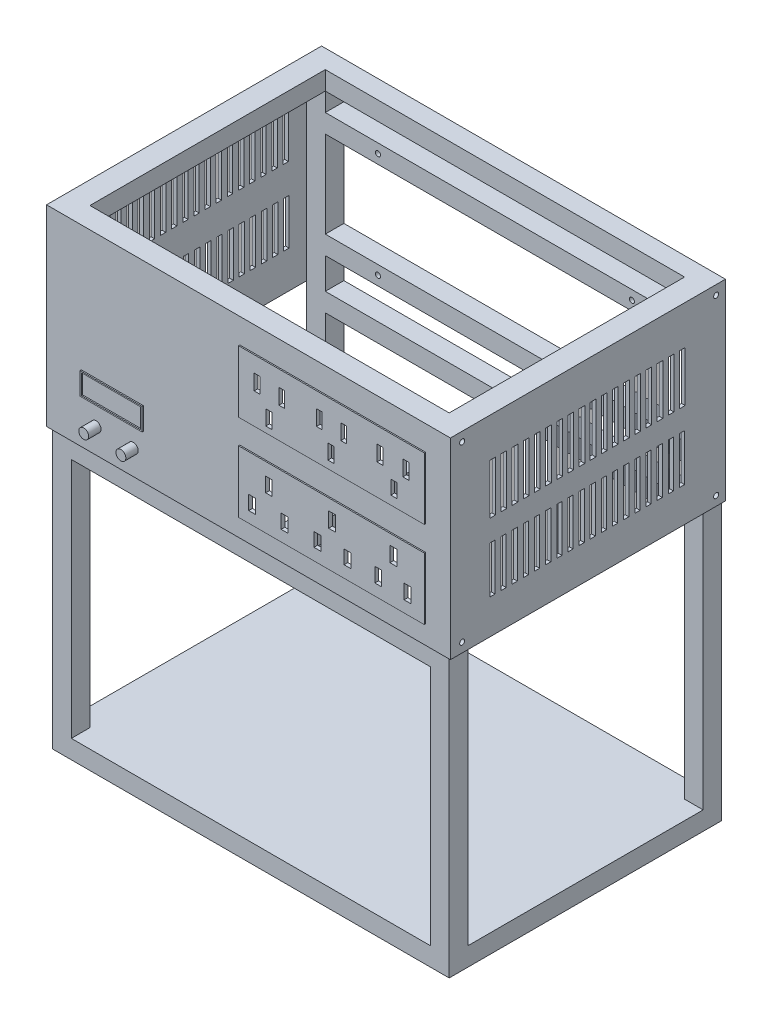
from build123d import *

# Parameters (mm, degrees)
SKETCH_1_W           = 320
SKETCH_1_H           = 220
EXTRUDE_2_DEPTH      = 380
SKETCH_3_W           = 290
SKETCH_3_H           = 350
CUT_EXTRUDE_1_DEPTH  = 220
SKETCH_4_W           = 190
SKETCH_4_H           = 350
CUT_EXTRUDE_2_DEPTH  = 320
SKETCH_5_W           = 290
SKETCH_5_H           = 190
CUT_EXTRUDE_3_DEPTH  = 15
SKETCH_6_W           = 290
SKETCH_6_H           = 15
EXTRUDE_3_DEPTH      = 15
SKETCH_7_W           = 290
SKETCH_7_H           = 15
EXTRUDE_4_DEPTH      = 15
SKETCH_8_R           = 2.05
CUT_EXTRUDE_4_DEPTH  = 15
SKETCH_9_R           = 2.05
CUT_EXTRUDE_5_DEPTH  = 15
SKETCH_10_R          = 2.05
CUT_EXTRUDE_6_DEPTH  = 15
SKETCH_11_R          = 2.05
CUT_EXTRUDE_7_DEPTH  = 15
SKETCH_12_W          = 290
SKETCH_12_H          = 15
EXTRUDE_5_DEPTH      = 15
SKETCH_13_W          = 290
SKETCH_13_H          = 15
EXTRUDE_6_DEPTH      = 15
SKETCH_14_W          = 15
SKETCH_14_H          = 15
EXTRUDE_7_DEPTH      = 220
SKETCH_15_W          = 220
SKETCH_15_H          = 155.000058457
EXTRUDE_9_DEPTH      = 3
SKETCH_17_R          = 2.05
CUT_EXTRUDE_9_DEPTH  = 3
SKETCH_18_R          = 2.05
CUT_EXTRUDE_10_DEPTH = 3
SKETCH_19_R          = 2.05
CUT_EXTRUDE_11_DEPTH = 3
SKETCH_20_R          = 2.05
CUT_EXTRUDE_12_DEPTH = 3
SKETCH_21_W          = 220
SKETCH_21_H          = 155.060128196
EXTRUDE_10_DEPTH     = 3
CUT_EXTRUDE_START    = -3
SKETCH_22_R          = 2.05
CUT_EXTRUDE_13_DEPTH = 3
SKETCH_23_R          = 2.05
CUT_EXTRUDE_14_DEPTH = 3
SKETCH_24_R          = 2.05
CUT_EXTRUDE_15_DEPTH = 3
SKETCH_25_R          = 2.05
CUT_EXTRUDE_16_DEPTH = 3
SKETCH_26_W          = 326
SKETCH_26_H          = 155.000058457
EXTRUDE_11_DEPTH     = 2
SKETCH_27_R          = 4
EXTRUDE_12_DEPTH     = 10
SKETCH_28_R          = 4
EXTRUDE_13_DEPTH     = 10
SKETCH_29_W          = 50
SKETCH_29_H          = 18
EXTRUDE_14_DEPTH     = 1
SKETCH_30_W          = 47.884184658
SKETCH_30_H          = 16.004072413
CUT_EXTRUDE_17_DEPTH = 1
SKETCH_31_W          = 150
SKETCH_31_H          = 50
EXTRUDE_15_DEPTH     = 1
SKETCH_35_W          = 4.499914726
SKETCH_35_H          = 12.461302318
SKETCH_35_W_2        = 5.019135656
SKETCH_35_H_2        = 12.115155031
CUT_EXTRUDE_18_DEPTH = 15
SKETCH_36_W          = 4.491620012
SKETCH_36_H          = 12.476722257
SKETCH_36_W_2        = 4.491620013
SKETCH_36_W_3        = 4.990688902
SKETCH_36_H_2        = 11.977653366
CUT_EXTRUDE_19_DEPTH = 15
SKETCH_37_W          = 4.86592168
SKETCH_37_H          = 12.601489479
SKETCH_37_W_2        = 5.115456125
SKETCH_37_H_2        = 11.229050031
CUT_EXTRUDE_20_DEPTH = 15
SKETCH_38_W          = 5.268219785
SKETCH_38_H          = 11.688862646
SKETCH_38_W_2        = 5.432851652
SKETCH_38_H_2        = 11.35959891
SKETCH_38_W_3        = 5.597483521
CUT_EXTRUDE_21_DEPTH = 15
SKETCH_39_W          = 5.432851652
SKETCH_39_H          = 12.182758251
SKETCH_39_W_2        = 5.597483521
SKETCH_39_H_2        = 11.030335173
SKETCH_39_W_3        = 5.432851653
CUT_EXTRUDE_22_DEPTH = 15
SKETCH_40_W          = 5.597483521
SKETCH_40_H          = 12.182758251
SKETCH_40_W_2        = 5.268219784
SKETCH_40_H_2        = 11.688862647
SKETCH_40_W_3        = 5.432851652
CUT_EXTRUDE_23_DEPTH = 15
SKETCH_41_W          = 4.27387979
SKETCH_41_H          = 35.491784345
CUT_EXTRUDE_26_DEPTH = 10
SKETCH_42_W          = 4.379051678
SKETCH_42_H          = 36.82384365
CUT_EXTRUDE_27_DEPTH = 10
SKETCH_43_W          = 4.615828939
SKETCH_43_H          = 40.516720687
CUT_EXTRUDE_28_DEPTH = 10
SKETCH_44_W          = 4.195645944
SKETCH_44_H          = 37.760813499
CUT_EXTRUDE_29_DEPTH = 10


with BuildPart() as part:
    # 草图1 → 凸台-拉伸2 (new body)
    with BuildSketch(Plane(origin=(0, 0, 0), x_dir=(1, 0, 0), z_dir=(0, 1, 0))):
        Rectangle(SKETCH_1_W, SKETCH_1_H)
    extrude(amount=EXTRUDE_2_DEPTH)

    # 草图3 → 切除-拉伸1 (cut)
    with BuildSketch(Plane.XY.offset(110)):
        with Locations((0, 190)):
            Rectangle(SKETCH_3_W, SKETCH_3_H)
    extrude(amount=-CUT_EXTRUDE_1_DEPTH, mode=Mode.SUBTRACT)

    # 草图4 → 切除-拉伸2 (cut)
    with BuildSketch(Plane(origin=(160, 0, 0), x_dir=(0, 0, -1), z_dir=(1, 0, 0))):
        with Locations((0, 190)):
            Rectangle(SKETCH_4_W, SKETCH_4_H)
    extrude(amount=-CUT_EXTRUDE_2_DEPTH, mode=Mode.SUBTRACT)

    # 草图5 → 切除-拉伸3 (cut)
    with BuildSketch(Plane(origin=(0, 380, 0), x_dir=(1, 0, 0), z_dir=(0, 1, 0))):
        Rectangle(SKETCH_5_W, SKETCH_5_H)
    extrude(amount=-CUT_EXTRUDE_3_DEPTH, mode=Mode.SUBTRACT)

    # 草图6 → 凸台-拉伸3 (add)
    with BuildSketch(Plane(origin=(0, 0, -110), x_dir=(-1, 0, 0), z_dir=(0, 0, -1))):
        with Locations((0, 342.5)):
            Rectangle(SKETCH_6_W, SKETCH_6_H)
    extrude(amount=-EXTRUDE_3_DEPTH)

    # 草图7 → 凸台-拉伸4 (add)
    with BuildSketch(Plane(origin=(0, 0, -110), x_dir=(-1, 0, 0), z_dir=(0, 0, -1))):
        with Locations((0, 257.5)):
            Rectangle(SKETCH_7_W, SKETCH_7_H)
    extrude(amount=-EXTRUDE_4_DEPTH)

    # 草图8 → 切除-拉伸4 (cut)
    with BuildSketch(Plane(origin=(0, 0, -110), x_dir=(-1, 0, 0), z_dir=(0, 0, -1))):
        with Locations((-102.5, 342.5)):
            Circle(SKETCH_8_R)
    extrude(amount=-CUT_EXTRUDE_4_DEPTH, mode=Mode.SUBTRACT)

    # 草图9 → 切除-拉伸5 (cut)
    with BuildSketch(Plane(origin=(0, 0, -110), x_dir=(-1, 0, 0), z_dir=(0, 0, -1))):
        with Locations((102.5, 342.5)):
            Circle(SKETCH_9_R)
    extrude(amount=-CUT_EXTRUDE_5_DEPTH, mode=Mode.SUBTRACT)

    # 草图10 → 切除-拉伸6 (cut)
    with BuildSketch(Plane(origin=(0, 0, -110), x_dir=(-1, 0, 0), z_dir=(0, 0, -1))):
        with Locations((-102.5, 257.5)):
            Circle(SKETCH_10_R)
    extrude(amount=-CUT_EXTRUDE_6_DEPTH, mode=Mode.SUBTRACT)

    # 草图11 → 切除-拉伸7 (cut)
    with BuildSketch(Plane(origin=(0, 0, -110), x_dir=(-1, 0, 0), z_dir=(0, 0, -1))):
        with Locations((102.5, 257.5)):
            Circle(SKETCH_11_R)
    extrude(amount=-CUT_EXTRUDE_7_DEPTH, mode=Mode.SUBTRACT)

    # 草图12 → 凸台-拉伸5 (add)
    with BuildSketch(Plane.XY.offset(110)):
        with Locations((0, 217.5)):
            Rectangle(SKETCH_12_W, SKETCH_12_H)
    extrude(amount=-EXTRUDE_5_DEPTH)

    # 草图13 → 凸台-拉伸6 (add)
    with BuildSketch(Plane(origin=(0, 0, -110), x_dir=(-1, 0, 0), z_dir=(0, 0, -1))):
        with Locations((0, 217.5)):
            Rectangle(SKETCH_13_W, SKETCH_13_H)
    extrude(amount=-EXTRUDE_6_DEPTH)

    # 草图14 → 凸台-拉伸7 (add)
    with BuildSketch(Plane(origin=(0, 0, -110), x_dir=(-1, 0, 0), z_dir=(0, 0, -1))):
        with Locations((-7.5, 217.5)):
            Rectangle(SKETCH_14_W, SKETCH_14_H)
    extrude(amount=-EXTRUDE_7_DEPTH)

    # 草图15 → 凸台-拉伸9 (add)
    with BuildSketch(Plane(origin=(160, 0, 0), x_dir=(0, 0, -1), z_dir=(1, 0, 0))):
        with Locations((0, 302.499970771)):
            Rectangle(SKETCH_15_W, SKETCH_15_H)
    extrude(amount=EXTRUDE_9_DEPTH)

    # 草图17 → 切除-拉伸9 (cut)
    with BuildSketch(Plane(origin=(163, 0, 0), x_dir=(0, 0, -1), z_dir=(1, 0, 0))):
        with Locations((-102.5, 372.5)):
            Circle(SKETCH_17_R)
    extrude(amount=-CUT_EXTRUDE_9_DEPTH, mode=Mode.SUBTRACT)

    # 草图18 → 切除-拉伸10 (cut)
    with BuildSketch(Plane(origin=(163, 0, 0), x_dir=(0, 0, -1), z_dir=(1, 0, 0))):
        with Locations((102.5, 372.5)):
            Circle(SKETCH_18_R)
    extrude(amount=-CUT_EXTRUDE_10_DEPTH, mode=Mode.SUBTRACT)

    # 草图19 → 切除-拉伸11 (cut)
    with BuildSketch(Plane(origin=(163, 0, 0), x_dir=(0, 0, -1), z_dir=(1, 0, 0))):
        with Locations((-102.5, 232.499941543)):
            Circle(SKETCH_19_R)
    extrude(amount=-CUT_EXTRUDE_11_DEPTH, mode=Mode.SUBTRACT)

    # 草图20 → 切除-拉伸12 (cut)
    with BuildSketch(Plane(origin=(163, 0, 0), x_dir=(0, 0, -1), z_dir=(1, 0, 0))):
        with Locations((102.5, 232.499941543)):
            Circle(SKETCH_20_R)
    extrude(amount=-CUT_EXTRUDE_12_DEPTH, mode=Mode.SUBTRACT)

    # 草图21 → 凸台-拉伸10 (add)
    with BuildSketch(Plane.ZY.offset(160)):
        with Locations((0, 302.469935902)):
            Rectangle(SKETCH_21_W, SKETCH_21_H)
    extrude(amount=EXTRUDE_10_DEPTH)

    # 草图22 → 切除-拉伸13 (cut)
    with BuildSketch(Plane.ZY.offset(163).offset(CUT_EXTRUDE_START)):
        with Locations(Location((-102.5, 372.5, 0), (0, 0, 180))):
            Circle(SKETCH_22_R)
    extrude(amount=CUT_EXTRUDE_13_DEPTH, mode=Mode.SUBTRACT)

    # 草图23 → 切除-拉伸14 (cut)
    with BuildSketch(Plane.ZY.offset(163).offset(CUT_EXTRUDE_START)):
        with Locations(Location((102.5, 372.5, 0), (0, 0, 180))):
            Circle(SKETCH_23_R)
    extrude(amount=CUT_EXTRUDE_14_DEPTH, mode=Mode.SUBTRACT)

    # 草图24 → 切除-拉伸15 (cut)
    with BuildSketch(Plane.ZY.offset(163)):
        with Locations((-102.5, 232.439871804)):
            Circle(SKETCH_24_R)
    extrude(amount=-CUT_EXTRUDE_15_DEPTH, mode=Mode.SUBTRACT)

    # 草图25 → 切除-拉伸16 (cut)
    with BuildSketch(Plane.ZY.offset(163)):
        with Locations((102.5, 232.439871804)):
            Circle(SKETCH_25_R)
    extrude(amount=-CUT_EXTRUDE_16_DEPTH, mode=Mode.SUBTRACT)

    # 草图26 → 凸台-拉伸11 (add)
    with BuildSketch(Plane.XY.offset(110)):
        with Locations((0, 302.499970771)):
            Rectangle(SKETCH_26_W, SKETCH_26_H)
    extrude(amount=EXTRUDE_11_DEPTH)

    # 草图27 → 凸台-拉伸12 (add)
    with BuildSketch(Plane.XY.offset(112)):
        with Locations((-123, 244.999941543)):
            Circle(SKETCH_27_R)
    extrude(amount=EXTRUDE_12_DEPTH)

    # 草图28 → 凸台-拉伸13 (add)
    with BuildSketch(Plane.XY.offset(112)):
        with Locations((-93, 244.999941543)):
            Circle(SKETCH_28_R)
    extrude(amount=EXTRUDE_13_DEPTH)

    # 草图29 → 凸台-拉伸14 (add)
    with BuildSketch(Plane.XY.offset(112)):
        with Locations((-109.907202063, 269.647198379)):
            Rectangle(SKETCH_29_W, SKETCH_29_H)
    extrude(amount=EXTRUDE_14_DEPTH)

    # 草图30 → 切除-拉伸17 (cut)
    with BuildSketch(Plane.XY.offset(113)):
        with Locations((-109.918600748, 269.66734461)):
            Rectangle(SKETCH_30_W, SKETCH_30_H)
    extrude(amount=-CUT_EXTRUDE_17_DEPTH, mode=Mode.SUBTRACT)

    # 草图31 → 凸台-拉伸15 (add)
    with BuildSketch(Plane.XY.offset(112)):
        with Locations((68, 335)):
            Rectangle(SKETCH_31_W, SKETCH_31_H)
        with Locations((68, 265)):
            Rectangle(SKETCH_31_W, SKETCH_31_H)
    extrude(amount=EXTRUDE_15_DEPTH)

    # 草图35 → 切除-拉伸18 (cut)
    with BuildSketch(Plane.XY.offset(113)):
        with Locations((7.855850568, 340.923710735)):
            Rectangle(SKETCH_35_W, SKETCH_35_H)
        with Locations((27.759319548, 340.923710735)):
            Rectangle(SKETCH_35_W, SKETCH_35_H)
        with Locations((17.461437772, 320.847168112)):
            Rectangle(SKETCH_35_W_2, SKETCH_35_H_2)
    extrude(amount=-CUT_EXTRUDE_18_DEPTH, mode=Mode.SUBTRACT)

    # 草图36 → 切除-拉伸19 (cut)
    with BuildSketch(Plane.XY.offset(113)):
        with Locations((58.103935401, 341.188883591)):
            Rectangle(SKETCH_36_W, SKETCH_36_H)
        with Locations((77.817156567, 341.188883591)):
            Rectangle(SKETCH_36_W_2, SKETCH_36_H)
        with Locations((67.586244316, 322.099498538)):
            Rectangle(SKETCH_36_W_3, SKETCH_36_H_2)
    extrude(amount=-CUT_EXTRUDE_19_DEPTH, mode=Mode.SUBTRACT)

    # 草图37 → 切除-拉伸20 (cut)
    with BuildSketch(Plane.XY.offset(113)):
        with Locations((107.075070259, 340.876965535)):
            Rectangle(SKETCH_37_W, SKETCH_37_H)
        with Locations((128.160730873, 340.876965535)):
            Rectangle(SKETCH_37_W_2, SKETCH_37_H)
        with Locations((118.30412029, 322.598567429)):
            Rectangle(SKETCH_37_W, SKETCH_37_H_2)
    extrude(amount=-CUT_EXTRUDE_20_DEPTH, mode=Mode.SUBTRACT)

    # 草图38 → 切除-拉伸21 (cut)
    with BuildSketch(Plane.XY.offset(113)):
        with Locations((17.443434229, 273.926591144)):
            Rectangle(SKETCH_38_W, SKETCH_38_H)
        with Locations((3.861305097, 254.50003069)):
            Rectangle(SKETCH_38_W_2, SKETCH_38_H_2)
        with Locations((30.120088085, 254.50003069)):
            Rectangle(SKETCH_38_W_3, SKETCH_38_H_2)
    extrude(amount=-CUT_EXTRUDE_21_DEPTH, mode=Mode.SUBTRACT)

    # 草图39 → 切除-拉伸22 (cut)
    with BuildSketch(Plane.XY.offset(113)):
        with Locations((68.396997454, 274.832066419)):
            Rectangle(SKETCH_39_W, SKETCH_39_H)
        with Locations((56.625818874, 254.993926294)):
            Rectangle(SKETCH_39_W_2, SKETCH_39_H_2)
        with Locations((80.909019442, 254.993926294)):
            Rectangle(SKETCH_39_W_3, SKETCH_39_H_2)
    extrude(amount=-CUT_EXTRUDE_22_DEPTH, mode=Mode.SUBTRACT)

    # 草图40 → 切除-拉伸23 (cut)
    with BuildSketch(Plane.XY.offset(113)):
        with Locations((118.033505734, 275.490593892)):
            Rectangle(SKETCH_40_W, SKETCH_40_H)
        with Locations((105.686115614, 254.993926295)):
            Rectangle(SKETCH_40_W_2, SKETCH_40_H_2)
        with Locations((129.310788709, 254.993926295)):
            Rectangle(SKETCH_40_W_3, SKETCH_40_H_2)
    extrude(amount=-CUT_EXTRUDE_23_DEPTH, mode=Mode.SUBTRACT)

    # 草图41 → 切除-拉伸26 (cut)
    with BuildSketch(Plane.ZY.offset(163)):
        with Locations((-69.094256058, 333.347868575)):
            Rectangle(SKETCH_41_W, SKETCH_41_H)
        with Locations((-78.094256058, 333.347868575)):
            Rectangle(SKETCH_41_W, SKETCH_41_H)
        with Locations((-60.094256058, 333.347868575)):
            Rectangle(SKETCH_41_W, SKETCH_41_H)
        with Locations((-51.094256058, 333.347868575)):
            Rectangle(SKETCH_41_W, SKETCH_41_H)
        with Locations((-42.094256058, 333.347868575)):
            Rectangle(SKETCH_41_W, SKETCH_41_H)
        with Locations((-33.094256058, 333.347868575)):
            Rectangle(SKETCH_41_W, SKETCH_41_H)
        with Locations((-24.094256058, 333.347868575)):
            Rectangle(SKETCH_41_W, SKETCH_41_H)
        with Locations((-15.094256058, 333.347868575)):
            Rectangle(SKETCH_41_W, SKETCH_41_H)
        with Locations((-6.094256058, 333.347868575)):
            Rectangle(SKETCH_41_W, SKETCH_41_H)
        with Locations((2.905743942, 333.347868575)):
            Rectangle(SKETCH_41_W, SKETCH_41_H)
        with Locations((11.905743942, 333.347868575)):
            Rectangle(SKETCH_41_W, SKETCH_41_H)
        with Locations((20.905743942, 333.347868575)):
            Rectangle(SKETCH_41_W, SKETCH_41_H)
        with Locations((29.905743942, 333.347868575)):
            Rectangle(SKETCH_41_W, SKETCH_41_H)
        with Locations((38.905743942, 333.347868575)):
            Rectangle(SKETCH_41_W, SKETCH_41_H)
        with Locations((47.905743942, 333.347868575)):
            Rectangle(SKETCH_41_W, SKETCH_41_H)
        with Locations((56.905743942, 333.347868575)):
            Rectangle(SKETCH_41_W, SKETCH_41_H)
        with Locations((65.905743942, 333.347868575)):
            Rectangle(SKETCH_41_W, SKETCH_41_H)
        with Locations((74.905743942, 333.347868575)):
            Rectangle(SKETCH_41_W, SKETCH_41_H)
    extrude(amount=-CUT_EXTRUDE_26_DEPTH, mode=Mode.SUBTRACT)

    # 草图42 → 切除-拉伸27 (cut)
    with BuildSketch(Plane.ZY.offset(163)):
        with Locations((-69.575954165, 273.270029144)):
            Rectangle(SKETCH_42_W, SKETCH_42_H)
        with Locations((-78.575954165, 273.270029144)):
            Rectangle(SKETCH_42_W, SKETCH_42_H)
        with Locations((-60.575954165, 273.270029144)):
            Rectangle(SKETCH_42_W, SKETCH_42_H)
        with Locations((-51.575954165, 273.270029144)):
            Rectangle(SKETCH_42_W, SKETCH_42_H)
        with Locations((-42.575954165, 273.270029144)):
            Rectangle(SKETCH_42_W, SKETCH_42_H)
        with Locations((-33.575954165, 273.270029144)):
            Rectangle(SKETCH_42_W, SKETCH_42_H)
        with Locations((-24.575954165, 273.270029144)):
            Rectangle(SKETCH_42_W, SKETCH_42_H)
        with Locations((-15.575954165, 273.270029144)):
            Rectangle(SKETCH_42_W, SKETCH_42_H)
        with Locations((-6.575954165, 273.270029144)):
            Rectangle(SKETCH_42_W, SKETCH_42_H)
        with Locations((2.424045835, 273.270029144)):
            Rectangle(SKETCH_42_W, SKETCH_42_H)
        with Locations((11.424045835, 273.270029144)):
            Rectangle(SKETCH_42_W, SKETCH_42_H)
        with Locations((20.424045835, 273.270029144)):
            Rectangle(SKETCH_42_W, SKETCH_42_H)
        with Locations((29.424045835, 273.270029144)):
            Rectangle(SKETCH_42_W, SKETCH_42_H)
        with Locations((38.424045835, 273.270029144)):
            Rectangle(SKETCH_42_W, SKETCH_42_H)
        with Locations((47.424045835, 273.270029144)):
            Rectangle(SKETCH_42_W, SKETCH_42_H)
        with Locations((56.424045835, 273.270029144)):
            Rectangle(SKETCH_42_W, SKETCH_42_H)
        with Locations((65.424045835, 273.270029144)):
            Rectangle(SKETCH_42_W, SKETCH_42_H)
        with Locations((74.424045835, 273.270029144)):
            Rectangle(SKETCH_42_W, SKETCH_42_H)
    extrude(amount=-CUT_EXTRUDE_27_DEPTH, mode=Mode.SUBTRACT)

    # 草图43 → 切除-拉伸28 (cut)
    with BuildSketch(Plane(origin=(163, 0, 0), x_dir=(0, 0, -1), z_dir=(1, 0, 0))):
        with Locations((-68.863550231, 328.209321002)):
            Rectangle(SKETCH_43_W, SKETCH_43_H)
        with Locations((-77.863550231, 328.209321002)):
            Rectangle(SKETCH_43_W, SKETCH_43_H)
        with Locations((-59.863550231, 328.209321002)):
            Rectangle(SKETCH_43_W, SKETCH_43_H)
        with Locations((-50.863550231, 328.209321002)):
            Rectangle(SKETCH_43_W, SKETCH_43_H)
        with Locations((-41.863550231, 328.209321002)):
            Rectangle(SKETCH_43_W, SKETCH_43_H)
        with Locations((-32.863550231, 328.209321002)):
            Rectangle(SKETCH_43_W, SKETCH_43_H)
        with Locations((-23.863550231, 328.209321002)):
            Rectangle(SKETCH_43_W, SKETCH_43_H)
        with Locations((-14.863550232, 328.209321002)):
            Rectangle(SKETCH_43_W, SKETCH_43_H)
        with Locations((-5.863550231, 328.209321002)):
            Rectangle(SKETCH_43_W, SKETCH_43_H)
        with Locations((3.136449769, 328.209321002)):
            Rectangle(SKETCH_43_W, SKETCH_43_H)
        with Locations((12.136449769, 328.209321002)):
            Rectangle(SKETCH_43_W, SKETCH_43_H)
        with Locations((21.136449769, 328.209321002)):
            Rectangle(SKETCH_43_W, SKETCH_43_H)
        with Locations((30.136449769, 328.209321002)):
            Rectangle(SKETCH_43_W, SKETCH_43_H)
        with Locations((39.136449769, 328.209321002)):
            Rectangle(SKETCH_43_W, SKETCH_43_H)
        with Locations((48.136449769, 328.209321002)):
            Rectangle(SKETCH_43_W, SKETCH_43_H)
        with Locations((57.136449769, 328.209321002)):
            Rectangle(SKETCH_43_W, SKETCH_43_H)
        with Locations((66.136449769, 328.209321002)):
            Rectangle(SKETCH_43_W, SKETCH_43_H)
        with Locations((75.136449769, 328.209321002)):
            Rectangle(SKETCH_43_W, SKETCH_43_H)
    extrude(amount=-CUT_EXTRUDE_28_DEPTH, mode=Mode.SUBTRACT)

    # 草图44 → 切除-拉伸29 (cut)
    with BuildSketch(Plane(origin=(163, 0, 0), x_dir=(0, 0, -1), z_dir=(1, 0, 0))):
        with Locations((-69.069774651, 271.78487947)):
            Rectangle(SKETCH_44_W, SKETCH_44_H)
        with Locations((-78.069774651, 271.78487947)):
            Rectangle(SKETCH_44_W, SKETCH_44_H)
        with Locations((-60.069774651, 271.78487947)):
            Rectangle(SKETCH_44_W, SKETCH_44_H)
        with Locations((-51.069774651, 271.78487947)):
            Rectangle(SKETCH_44_W, SKETCH_44_H)
        with Locations((-42.069774651, 271.78487947)):
            Rectangle(SKETCH_44_W, SKETCH_44_H)
        with Locations((-33.069774651, 271.78487947)):
            Rectangle(SKETCH_44_W, SKETCH_44_H)
        with Locations((-24.069774651, 271.78487947)):
            Rectangle(SKETCH_44_W, SKETCH_44_H)
        with Locations((-15.069774651, 271.78487947)):
            Rectangle(SKETCH_44_W, SKETCH_44_H)
        with Locations((-6.069774651, 271.78487947)):
            Rectangle(SKETCH_44_W, SKETCH_44_H)
        with Locations((2.930225349, 271.78487947)):
            Rectangle(SKETCH_44_W, SKETCH_44_H)
        with Locations((11.930225349, 271.78487947)):
            Rectangle(SKETCH_44_W, SKETCH_44_H)
        with Locations((20.930225349, 271.78487947)):
            Rectangle(SKETCH_44_W, SKETCH_44_H)
        with Locations((29.930225349, 271.78487947)):
            Rectangle(SKETCH_44_W, SKETCH_44_H)
        with Locations((38.930225349, 271.78487947)):
            Rectangle(SKETCH_44_W, SKETCH_44_H)
        with Locations((47.930225349, 271.78487947)):
            Rectangle(SKETCH_44_W, SKETCH_44_H)
        with Locations((56.930225349, 271.78487947)):
            Rectangle(SKETCH_44_W, SKETCH_44_H)
        with Locations((65.930225349, 271.78487947)):
            Rectangle(SKETCH_44_W, SKETCH_44_H)
        with Locations((74.930225349, 271.78487947)):
            Rectangle(SKETCH_44_W, SKETCH_44_H)
    extrude(amount=-CUT_EXTRUDE_29_DEPTH, mode=Mode.SUBTRACT)


solid = part.part
